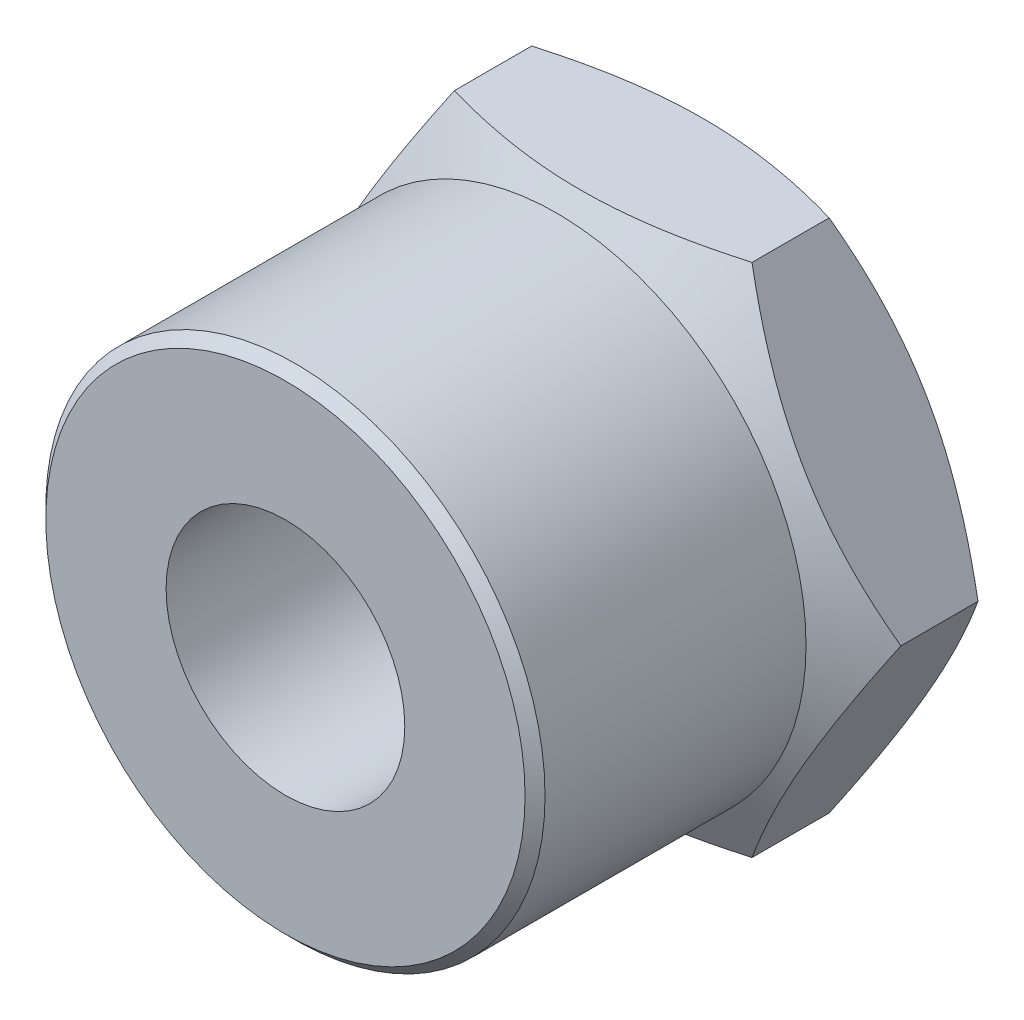
from build123d import *

# Parameters (mm, degrees)
SKETCH1_R      = 1.621
BASENUT_DEPTH  = 2.32
EXTRUDE1_START = 3.68
SKETCH2_R      = 3.39
SKETCH2_R_2    = 1.621
EXTRUDE1_DEPTH = 3.68
CHAMFER1_SIZE  = 0.1356


with BuildPart() as part:
    # Sketch1 → BaseNut (new body)
    with BuildSketch(Plane.XY):
        Polygon((2.020725942, -3.5), (4.041451884, 0), (2.020725942, 3.5), (-2.020725942, 3.5), (-4.041451884, 0), (-2.020725942, -3.5), align=None)
        Circle(SKETCH1_R, mode=Mode.SUBTRACT)
    extrude(amount=-BASENUT_DEPTH)

    # Sketch3 → Double-Chamfer (revolve, cut)
    with BuildSketch(Plane(origin=(0, 0, 0), x_dir=(1, 0, 0), z_dir=(0, 1, 0))):
        Polygon((2.94, 2.32), (4.041451884, 2.32), (4.041451884, 1.684076458), align=None)
        Polygon((4.041451884, 0.635923542), (2.94, 0), (4.041451884, 0), align=None)
    revolve(axis=Axis((0, 0, -16.31077227), (0, 0, 1)), mode=Mode.SUBTRACT)

    # Sketch2 → Extrude1 (add)
    with BuildSketch(Plane(origin=(20.087129569, -4.281493882, 0), x_dir=(1, 0, 0), z_dir=(0, 0, 1)).offset(EXTRUDE1_START)):
        with Locations((-20.087129569, 4.281493882)):
            Circle(SKETCH2_R)
        with Locations((-20.087129569, 4.281493882)):
            Circle(SKETCH2_R_2, mode=Mode.SUBTRACT)
    extrude(amount=-EXTRUDE1_DEPTH)

    # Sketch5 → EndChamfer (revolve, cut)
    with BuildSketch(Plane(origin=(0, 0, 0), x_dir=(1, 0, 0), z_dir=(0, 1, 0))):
        Polygon((1.621, 2.32), (2.3, 2.32), (1.621, 1.641), align=None)
    revolve(axis=Axis((0, 0, -16.800797033), (0, 0, 1)), mode=Mode.SUBTRACT)

    # Chamfer1
    chamfer1_edges = [part.edges().sort_by_distance(p)[0] for p in [
        (-3.39, 0, 3.68),
    ]]
    chamfer(chamfer1_edges, length=CHAMFER1_SIZE)


solid = part.part
